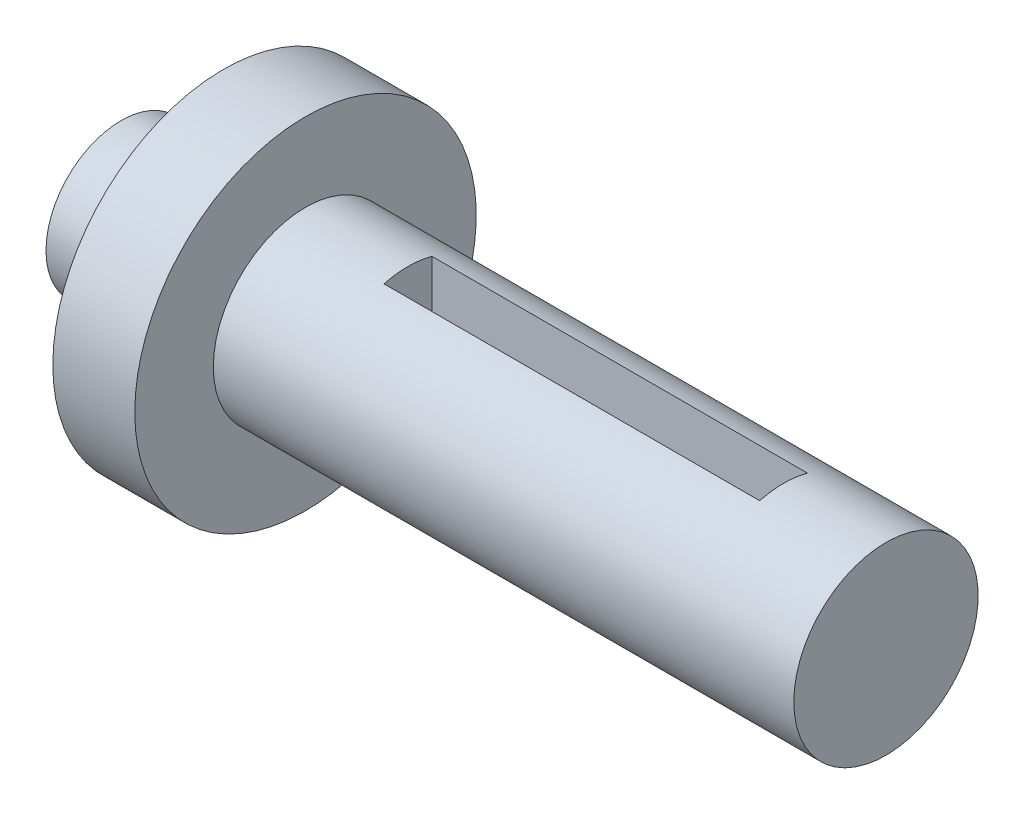
from build123d import *

# Parameters (mm, degrees)
CUT_EXTRUDE1_DEPTH      = 118.447860772
CUT_EXTRUDE1_DEPTH_BACK = 118.447860772
SKETCH4_W               = 55
SKETCH4_H               = 7


with BuildPart() as part:
    # Sketch1 → Revolve3 (revolve)
    with BuildSketch(Plane(origin=(0, 0, 0), x_dir=(1, 0, 0), z_dir=(0, 1, 0)), mode=Mode.PRIVATE) as revolve3_sk:
        Polygon((0, 0), (112, 0), (112, 13.5), (27, 13.5), (27, 25), (15, 25), (15, 11), (0, 11), align=None)
    revolve(revolve3_sk.sketch.rotate(Axis((0, 0, 0), (1, 0, 0)), 180), axis=Axis((0, 0, 0), (1, 0, 0)))

    # Sketch4 → Cut-Extrude1 (cut, two sides: drawn at the far end of the back side and taken through both)
    with BuildSketch(Plane(origin=(0, 0, 0), x_dir=(1, 0, 0), z_dir=(0, 1, 0)).offset(-CUT_EXTRUDE1_DEPTH_BACK)):
        with Locations((69.5, 0)):
            Rectangle(SKETCH4_W, SKETCH4_H)
    extrude(amount=CUT_EXTRUDE1_DEPTH + CUT_EXTRUDE1_DEPTH_BACK, mode=Mode.SUBTRACT)


solid = part.part
